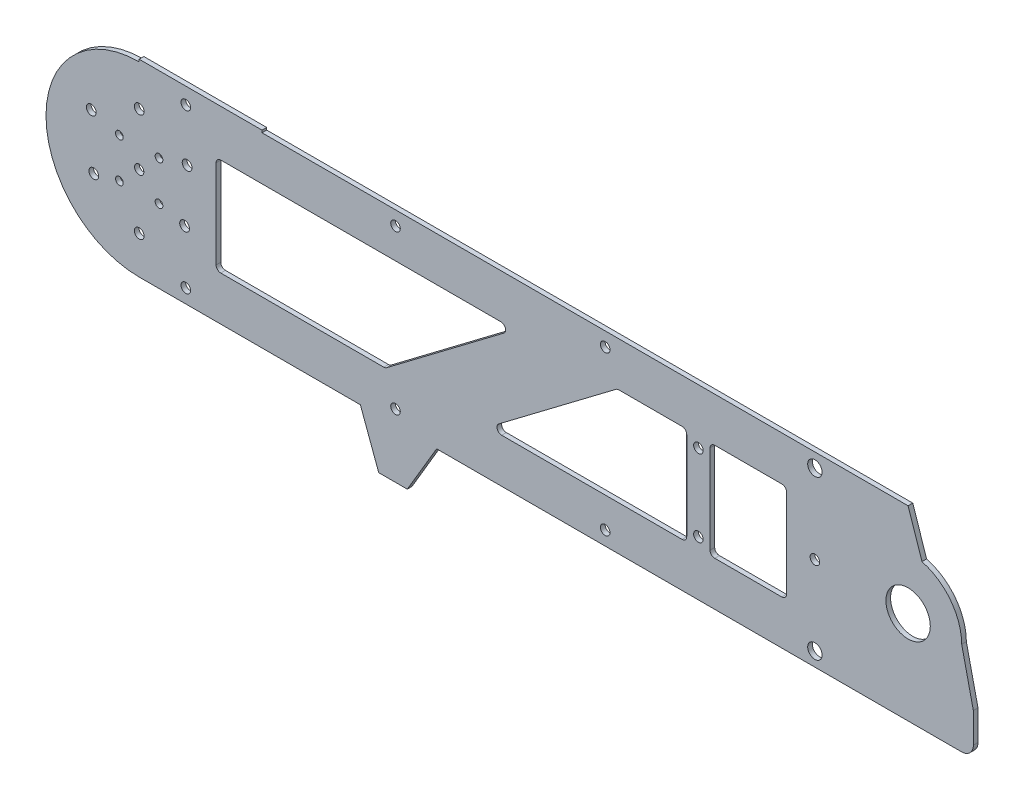
from build123d import *

# Parameters (mm, degrees)
SKETCH_1_R          = 2.1
SKETCH_1_R_2        = 2
SKETCH_1_R_3        = 9.52
SKETCH_1_R_4        = 2.05
SKETCH_1_R_5        = 1.65
EXTRUDE_1_DEPTH     = 2
SKETCH_3_W          = 52.726125437
SKETCH_3_H          = 0.98
EXTRUDE_2_DEPTH     = 2
SKETCH_2_R          = 2.05
SKETCH_2_R_2        = 3.1
SKETCH_2_W          = 32.809844138
SKETCH_2_H          = 42
CUT_EXTRUDE_1_DEPTH = 4
FILLET_1_R          = 2
FILLET_2_R          = 5


with BuildPart() as part:
    # 草图1 → 凸台-拉伸1 (new body)
    with BuildSketch(Plane.XY):
        with BuildLine():
            Line((-1.457142857, 39.854285714), (328.542857143, 39.854285714))
            Line((328.542857143, 39.854285714), (334.49569518, 22.070579719))
            ThreePointArc((334.49569518, 22.070579719), (346.78998397, 13.855798581), (351.542857143, -0.145714286))
            Line((351.542857143, -0.145714286), (356.542857143, -22.235997541))
            Line((356.542857143, -22.235997541), (356.542857143, -40.145714286))
            Line((356.542857143, -40.145714286), (328.542857143, -40.145714286))
            Line((328.542857143, -40.145714286), (126.194823947, -40.145714286))
            Line((126.194823947, -40.145714286), (113.608549915, -61.445714286))
            Line((113.608549915, -61.445714286), (101.341389716, -61.445714286))
            Line((101.341389716, -61.445714286), (93.462833584, -40.145714286))
            Line((93.462833584, -40.145714286), (-1.457142857, -40.145714286))
            ThreePointArc((-1.457142857, -40.145714286), (-41.457142857, -0.145714286), (-1.457142857, 39.854285714))
        make_face()
        with Locations((-1.457142857, -23.895714286)):
            Circle(SKETCH_1_R, mode=Mode.SUBTRACT)
        with Locations((18.028428728, -11.395714286)):
            Circle(SKETCH_1_R, mode=Mode.SUBTRACT)
        with Locations((-1.457142857, -0.145714286)):
            Circle(SKETCH_1_R_2, mode=Mode.SUBTRACT)
        with Locations((328.542857143, -0.145714286)):
            Circle(SKETCH_1_R_3, mode=Mode.SUBTRACT)
        with Locations((288.542857143, -0.145714286)):
            Circle(SKETCH_1_R_4, mode=Mode.SUBTRACT)
        with Locations((238.542857143, 16.354285714)):
            Circle(SKETCH_1_R_4, mode=Mode.SUBTRACT)
        with Locations(Location((238.542857143, -16.645714286, 0), (0, 0, 180))):
            Circle(SKETCH_1_R_4, mode=Mode.SUBTRACT)
        with Locations((-20.942714442, -11.395714286)):
            Circle(SKETCH_1_R, mode=Mode.SUBTRACT)
        with Locations((-22.025246197, 11.729285714)):
            Circle(SKETCH_1_R, mode=Mode.SUBTRACT)
        with Locations((-1.457142857, 22.354285714)):
            Circle(SKETCH_1_R, mode=Mode.SUBTRACT)
        with Locations((19.110960483, 11.729285714)):
            Circle(SKETCH_1_R, mode=Mode.SUBTRACT)
        with Locations((7.042857143, -8.645714286)):
            Circle(SKETCH_1_R_5, mode=Mode.SUBTRACT)
        with Locations((-9.957142857, -8.645714286)):
            Circle(SKETCH_1_R_5, mode=Mode.SUBTRACT)
        with Locations((-9.957142857, 8.354285714)):
            Circle(SKETCH_1_R_5, mode=Mode.SUBTRACT)
        with Locations((7.042857143, 8.354285714)):
            Circle(SKETCH_1_R_5, mode=Mode.SUBTRACT)
    extrude(amount=EXTRUDE_1_DEPTH)

    # 草图3 → 凸台-拉伸2 (add)
    with BuildSketch(Plane.XY.offset(2)):
        with Locations((24.905919862, 40.344285714)):
            Rectangle(SKETCH_3_W, SKETCH_3_H)
    extrude(amount=-EXTRUDE_2_DEPTH)

    # 草图2 → 切除-拉伸1 (cut)
    with BuildSketch(Plane.XY.offset(2)):
        with Locations((18.542857143, 33.854285714)):
            Circle(SKETCH_2_R)
        with Locations((108.542857143, 33.854285714)):
            Circle(SKETCH_2_R)
        with Locations((198.542857143, 33.854285714)):
            Circle(SKETCH_2_R)
        with Locations((108.542857143, -34.145714286)):
            Circle(SKETCH_2_R)
        with Locations((198.542857143, -34.145714286)):
            Circle(SKETCH_2_R)
        with Locations((288.542857143, -34.145714286)):
            Circle(SKETCH_2_R_2)
        with Locations((18.542857143, -34.145714286)):
            Circle(SKETCH_2_R)
        with Locations((288.542857143, 33.854285714)):
            Circle(SKETCH_2_R_2)
        Polygon((31.542857143, -21.145714286), (104.183898028, -21.145714286), (159.772133322, 20.854285714), (31.542857143, 20.854285714), align=None)
        Polygon((148.123425102, -21.145714286), (203.711660396, 20.854285714), (233.542857143, 20.854285714), (233.542857143, -21.145714286), align=None)
        with Locations((259.947779212, -0.145714286)):
            Rectangle(SKETCH_2_W, SKETCH_2_H)
    extrude(amount=-CUT_EXTRUDE_1_DEPTH, mode=Mode.SUBTRACT)

    # 圆角1
    fillet_1_edges = [part.edges().sort_by_distance(p)[0] for p in [
        (31.542857143, -21.145714286, 1),
        (31.542857143, 20.854285714, 1),
        (159.772133322, 20.854285714, 1),
        (104.183898028, -21.145714286, 1),
        (243.542857143, 20.854285714, 1),
        (276.352701281, 20.854285714, 1),
        (276.352701281, -21.145714286, 1),
        (243.542857143, -21.145714286, 1),
        (203.711660396, 20.854285714, 1),
        (233.542857143, 20.854285714, 1),
        (233.542857143, -21.145714286, 1),
        (148.123425102, -21.145714286, 1),
    ]]
    fillet(fillet_1_edges, radius=FILLET_1_R)

    # 圆角2
    fillet_2_edges = [part.edges().sort_by_distance(p)[0] for p in [
        (356.542857143, -40.145714286, 1),
    ]]
    fillet(fillet_2_edges, radius=FILLET_2_R)


solid = part.part
